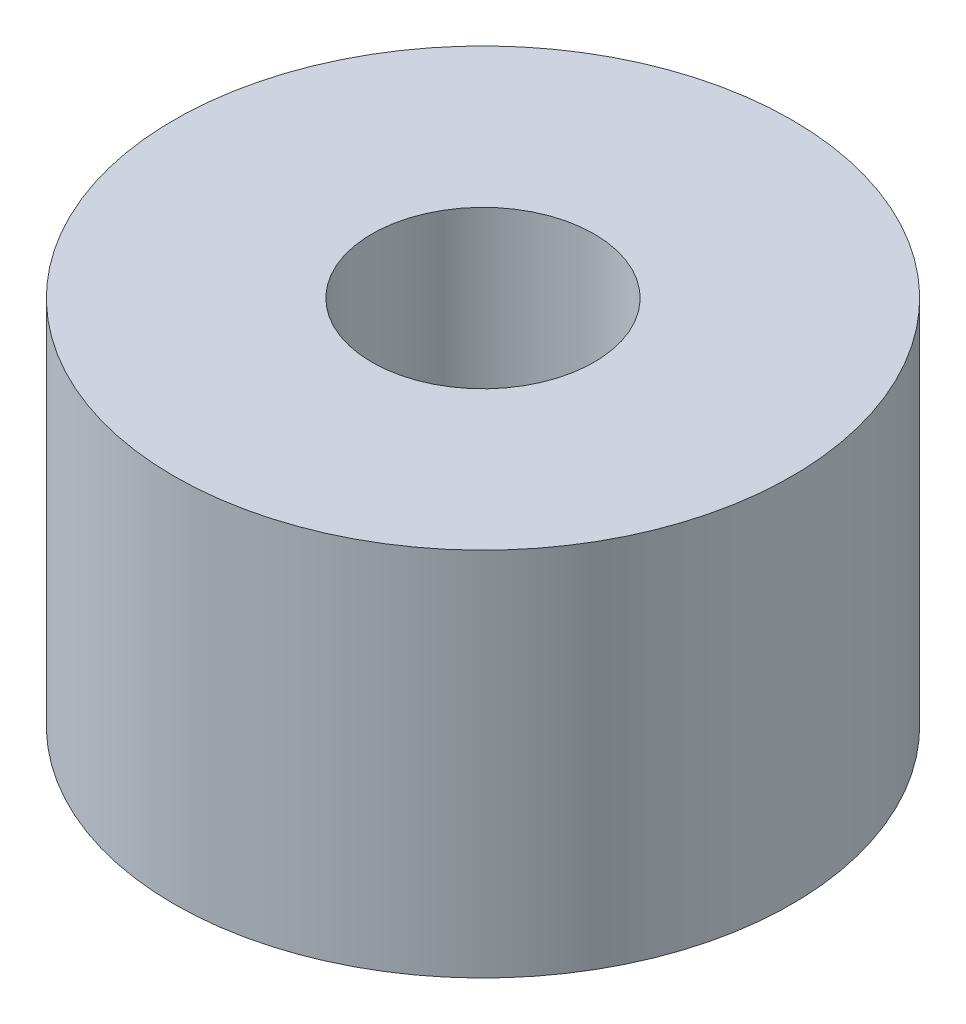
from build123d import *

# Parameters (mm, degrees)
SKETCH_1_R      = 5
SKETCH_1_R_2    = 1.8
EXTRUDE_1_DEPTH = 6


with BuildPart() as part:
    # 草图1 → 凸台-拉伸1 (new body)
    with BuildSketch(Plane(origin=(0, 0, 0), x_dir=(1, 0, 0), z_dir=(0, 1, 0))):
        with Locations(Location((0, 0, 0), (0, 0, 270))):
            Circle(SKETCH_1_R)
        with Locations(Location((0, 0, 0), (0, 0, 270))):
            Circle(SKETCH_1_R_2, mode=Mode.SUBTRACT)
    extrude(amount=EXTRUDE_1_DEPTH)


solid = part.part
